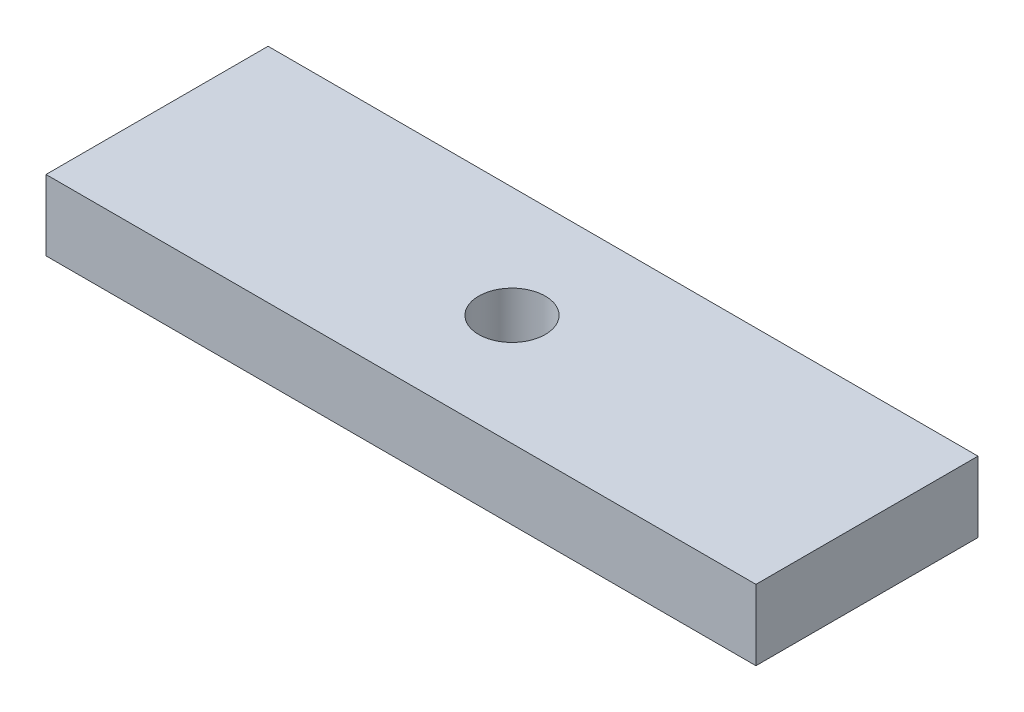
from build123d import *

# Parameters (mm, degrees)
SKETCH1_W           = 63.94
SKETCH1_H           = 20
SKETCH1_R           = 3
BOSS_EXTRUDE1_DEPTH = 6.35


with BuildPart() as part:
    # Sketch1 → Boss-Extrude1 (new body)
    with BuildSketch(Plane(origin=(0, 0, 0), x_dir=(1, 0, 0), z_dir=(0, 1, 0))):
        Rectangle(SKETCH1_W, SKETCH1_H)
        with Locations(Location((0, 0, 0), (0, 0, 270))):
            Circle(SKETCH1_R, mode=Mode.SUBTRACT)
    extrude(amount=BOSS_EXTRUDE1_DEPTH)


solid = part.part
